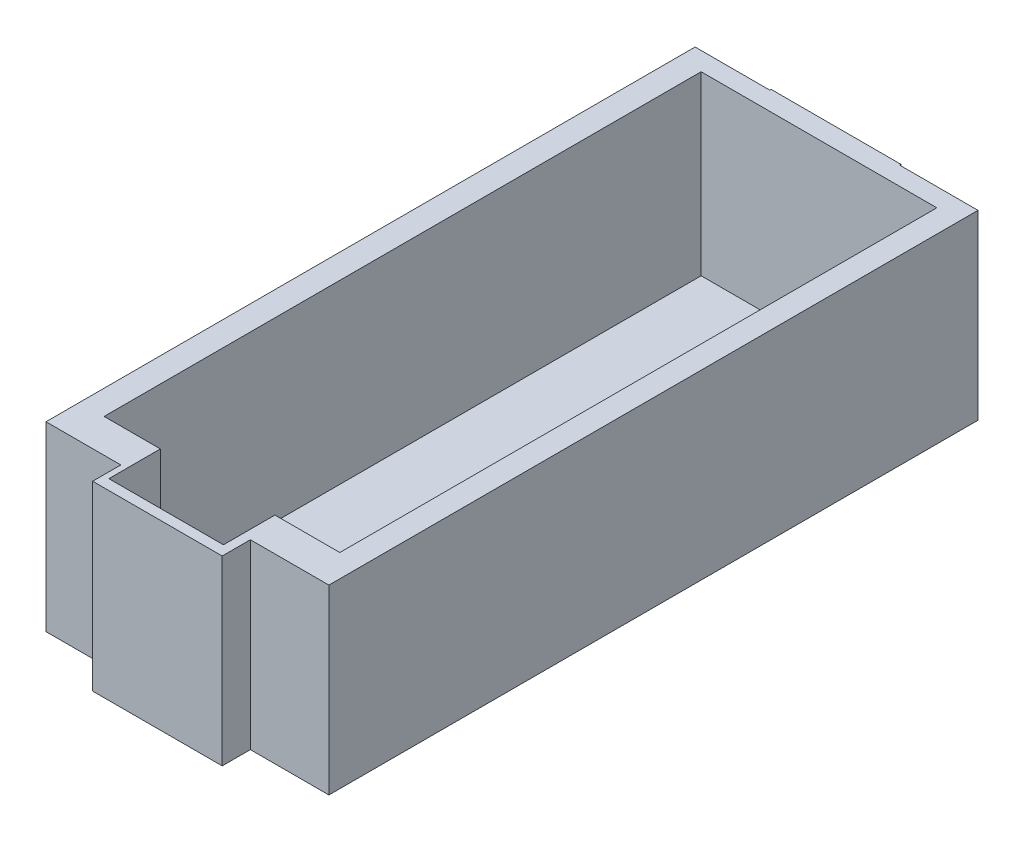
from build123d import *

# Parameters (mm, degrees)
BOSS_EXTRUDE1_DEPTH = 27.94
SKETCH2_W           = 5.576427518
SKETCH2_H           = 7.825401813
BOSS_EXTRUDE4_DEPTH = 29.21
SKETCH8_W           = 10.146325875
SKETCH8_H           = 25.699088163
CUT_EXTRUDE2_DEPTH  = 7.606325874
SKETCH10_W          = 4.931914879
SKETCH10_H          = 2.216881434
CUT_EXTRUDE3_DEPTH  = 7.606325874


with BuildPart() as part:
    # 3DSketch1 → Boss-Extrude1 (new body)
    with BuildSketch(Plane(origin=(-4.102739017, 20.36405405, 0.057228779), x_dir=(0.8412817346270438, -0.540596932087958, 0), z_dir=(0, 0, -1))):
        Polygon((0, 0), (4.230388213, 6.583367612), (14.475483209, 0), (10.245094996, -6.583367612), align=None)
    extrude(amount=-BOSS_EXTRUDE1_DEPTH)

    # Sketch2 → Boss-Extrude4 (add)
    with BuildSketch(Plane.XY):
        with Locations((1.905853526, 16.451353144)):
            Rectangle(SKETCH2_W, SKETCH2_H)
    extrude(amount=BOSS_EXTRUDE4_DEPTH)

    # Sketch8 → Cut-Extrude2 (cut)
    with BuildSketch(Plane(origin=(0, 20.36405405, 0), x_dir=(1, 0, 0), z_dir=(0, 1, 0))):
        with Locations((2.022741779, -13.698787424)):
            Rectangle(SKETCH8_W, SKETCH8_H)
    extrude(amount=-CUT_EXTRUDE2_DEPTH, mode=Mode.SUBTRACT)

    # Sketch10 → Cut-Extrude3 (cut)
    with BuildSketch(Plane(origin=(0, 20.36405405, 0), x_dir=(1, 0, 0), z_dir=(0, 1, 0))):
        with Locations((1.837563479, -27.656772222)):
            Rectangle(SKETCH10_W, SKETCH10_H)
    extrude(amount=-CUT_EXTRUDE3_DEPTH, mode=Mode.SUBTRACT)


solid = part.part
